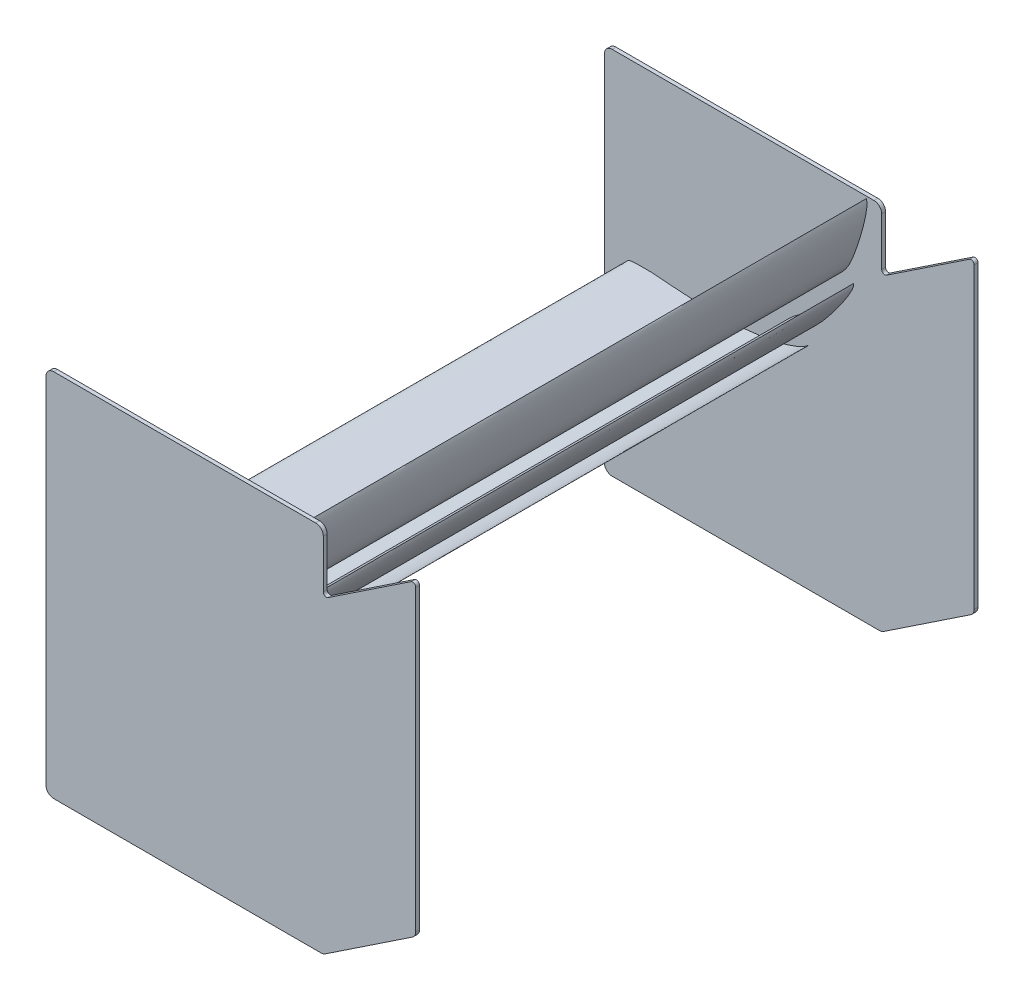
from build123d import *

# Parameters (mm, degrees)
BOSS_EXTRUDE1_DEPTH   = 457.2
BOSS_EXTRUDE1_2_DEPTH = 457.2
BOSS_EXTRUDE1_3_DEPTH = 457.2
SKETCH2_W             = 609.6
SKETCH2_H             = 609.6
BOSS_EXTRUDE2_DEPTH   = 6.35
CUT_EXTRUDE1_DEPTH    = 802.434403286
FILLET1_R             = 12.7
FILLET2_R             = 5.08


with BuildPart() as part:
    # Sketch1 → Boss-Extrude1 (new body)
    with BuildSketch(Plane.XY):
        with BuildLine():
            add(Edge.make_bspline(
                [(393.592739261, 288.346168055), (393.588820666, 288.346982898), (393.700690812, 287.655508378), (393.781579471, 286.908739604), (393.985442181, 284.967944897), (394.011725329, 282.452127067), (393.744454543, 279.067657192), (393.111282616, 275.075008274), (392.133345077, 270.514735181), (390.799217386, 265.484600894), (389.106489542, 260.051991759), (387.066182458, 254.292771701), (384.688600834, 248.282023779), (382.002029827, 242.092168445), (379.035294325, 235.794986076), (375.823030394, 229.460015305), (372.409485458, 223.151600098), (368.84167403, 216.93035856), (365.164200349, 210.854622388), (361.436467907, 204.970293648), (357.708308215, 199.322690258), (354.037147712, 193.948697266), (350.476057907, 188.878550101), (347.080927799, 184.135630335), (343.907393687, 179.733743247), (340.989793523, 175.685634093), (338.414599394, 171.923983227), (336.193200554, 168.419327874), (334.240625142, 165.213473878), (332.556462529, 162.326680984), (331.161408294, 159.786876212), (330.043654683, 157.635059186), (329.291548265, 155.86027552), (328.760233621, 154.554309494), (328.769589848, 153.394514108), (329.560454732, 152.715220708), (330.532294659, 152.20970073), (331.809851775, 151.88778366), (333.300191769, 151.766971046), (334.981201777, 151.878682049), (336.820730001, 152.233126013), (338.795136608, 152.890431356), (340.889679059, 153.849962511), (343.108390161, 155.081774595), (345.422265804, 156.598445557), (347.807181557, 158.394943192), (350.242618389, 160.465008768), (352.700102604, 162.811630509), (355.165323159, 165.419778956), (357.608143837, 168.287517472), (360.005969824, 171.408423599), (362.314130663, 174.79895484), (364.534653627, 178.459244555), (366.635689667, 182.423242356), (368.634788241, 186.684686876), (370.608508371, 191.198223557), (372.524007771, 195.951320397), (374.397359211, 200.905081481), (376.234904614, 206.023268877), (378.045854825, 211.259573163), (379.820915145, 216.568791762), (381.55512035, 221.902439326), (383.225308628, 227.222209295), (384.816697843, 232.490821437), (386.320164101, 237.674009405), (387.719679805, 242.741190647), (389.012797939, 247.660544998), (390.187380265, 252.402955689), (391.242055663, 256.938145967), (392.169544126, 261.238813051), (392.964570259, 265.279206189), (393.623921192, 269.03553403), (394.147236545, 272.485527514), (394.530778768, 275.610243672), (394.775632372, 278.392028119), (394.882726985, 280.816937707), (394.86231843, 282.876422035), (394.662580109, 284.618021211), (394.299795545, 285.992189628), (393.916147399, 287.192443924), (393.721364137, 287.743250305), (393.596579778, 288.345369449), (393.592739261, 288.346168055)],
                knots=[0, 0, 0, 0, 0.000999594, 0.004147435, 0.009748209, 0.018044377, 0.028864178, 0.04183079, 0.056713807, 0.073341232, 0.091507989, 0.111021837, 0.131661709, 0.153207715, 0.175433402, 0.198110317, 0.221011446, 0.243905882, 0.266573311, 0.288810349, 0.310405036, 0.331177743, 0.350943876, 0.3695564, 0.386864963, 0.402753039, 0.417195876, 0.430379519, 0.442362633, 0.453032156, 0.462284346, 0.470026206, 0.476176645, 0.480649947, 0.483553073, 0.486420689, 0.489953231, 0.494096927, 0.498850588, 0.50419675, 0.510125492, 0.516691031, 0.524011699, 0.532092122, 0.540897921, 0.550403414, 0.560581041, 0.571396483, 0.582828081, 0.594829641, 0.607347037, 0.620384325, 0.633968937, 0.648199967, 0.663193937, 0.678898581, 0.695226562, 0.712113221, 0.729459406, 0.747143117, 0.765009772, 0.782904928, 0.800688045, 0.818242105, 0.835449083, 0.852211621, 0.868429578, 0.884009363, 0.898854951, 0.912881827, 0.92601075, 0.938166771, 0.949289699, 0.959322172, 0.968216949, 0.97594822, 0.982474409, 0.987904723, 0.992516501, 0.996351138, 0.999020322, 1, 1, 1, 1], degree=3))
        make_face()
    extrude(amount=BOSS_EXTRUDE1_DEPTH)



with BuildPart() as body_2:
    # Sketch1 → Boss-Extrude1 2 (new body)
    with BuildSketch(Plane.XY):
        with BuildLine():
            add(Edge.make_bspline(
                [(298.35656861, 31.35853898), (298.353929072, 31.366096112), (297.283745146, 30.462041839), (296.086855075, 29.554142909), (292.96967767, 27.205487673), (288.683797757, 24.568945618), (282.60637468, 21.540875476), (275.109423189, 18.513611595), (266.284239098, 15.492695206), (256.286652726, 12.59841511), (245.229704329, 9.904315923), (233.254802442, 7.469649731), (220.501279173, 5.354092099), (207.122423277, 3.583751386), (193.270982166, 2.183151341), (179.101846113, 1.164544246), (164.77090042, 0.518354394), (150.430493327, 0.226424446), (136.226570648, 0.272373899), (122.299014003, 0.601647917), (108.776843715, 1.175499522), (95.782446704, 1.933474987), (83.422324309, 2.815736789), (71.794130294, 3.750557278), (60.978841147, 4.656777712), (51.03367721, 5.488659935), (41.932302919, 6.028617493), (33.635941017, 6.226776496), (26.128733222, 6.271870346), (19.444988538, 6.185472078), (13.65390124, 5.960869503), (8.81359552, 5.660537796), (4.996295589, 5.121737528), (2.2101383, 4.68734415), (0.231498565, 3.47662688), (-0.118386561, 1.421095916), (0.016052179, -0.765686971), (0.780159723, -3.287446437), (2.108210162, -5.966834049), (4.031288516, -8.73357683), (6.533778218, -11.522039441), (9.694408668, -14.229758447), (13.496904351, -16.832114888), (17.89408382, -19.366867852), (22.877633442, -21.771338344), (28.414076335, -24.009352574), (34.471546774, -26.052181026), (41.0258375, -27.84793216), (48.036441526, -29.387553548), (55.46899621, -30.621376512), (63.289216932, -31.517281604), (71.479303386, -31.981736227), (80.04157244, -32.018078442), (89.001418146, -31.536737631), (98.3661837, -30.574249123), (108.136977838, -29.30857935), (118.258486462, -27.696334558), (128.680585135, -25.805134609), (139.347682578, -23.683179508), (150.189876821, -21.393961956), (161.120101271, -18.968109829), (172.050121263, -16.44705467), (182.890408101, -13.830548059), (193.561824275, -11.131649945), (203.996227488, -8.370015866), (214.124679371, -5.549671519), (223.890108899, -2.699199091), (233.230096881, 0.17221793), (242.091326473, 3.035742743), (250.419492608, 5.875731769), (258.165015826, 8.67470357), (265.283800289, 11.41365917), (271.737298157, 14.070277557), (277.489184883, 16.631453444), (282.510312072, 19.07714225), (286.777734089, 21.391387781), (290.287356969, 23.54780056), (293.067295017, 25.684198648), (295.049383756, 27.721630892), (296.711834421, 29.615685508), (297.455459266, 30.51698171), (298.359155556, 31.351132423), (298.35656861, 31.35853898)],
                knots=[0, 0, 0, 0, 0.000999594, 0.004147435, 0.009748209, 0.018044377, 0.028864178, 0.04183079, 0.056713807, 0.073341232, 0.091507989, 0.111021837, 0.131661709, 0.153207715, 0.175433402, 0.198110317, 0.221011446, 0.243905882, 0.266573311, 0.288810349, 0.310405036, 0.331177743, 0.350943876, 0.3695564, 0.386864963, 0.402753039, 0.417195876, 0.430379519, 0.442362633, 0.453032156, 0.462284346, 0.470026206, 0.476176645, 0.480649947, 0.483553073, 0.486420689, 0.489953231, 0.494096927, 0.498850588, 0.50419675, 0.510125492, 0.516691031, 0.524011699, 0.532092122, 0.540897921, 0.550403414, 0.560581041, 0.571396483, 0.582828081, 0.594829641, 0.607347037, 0.620384325, 0.633968937, 0.648199967, 0.663193937, 0.678898581, 0.695226562, 0.712113221, 0.729459406, 0.747143117, 0.765009772, 0.782904928, 0.800688045, 0.818242105, 0.835449083, 0.852211621, 0.868429578, 0.884009363, 0.898854951, 0.912881827, 0.92601075, 0.938166771, 0.949289699, 0.959322172, 0.968216949, 0.97594822, 0.982474409, 0.987904723, 0.992516501, 0.996351138, 0.999020322, 1, 1, 1, 1], degree=3))
        make_face()
    extrude(amount=BOSS_EXTRUDE1_2_DEPTH)


with BuildPart() as body_3:
    # Sketch1 → Boss-Extrude1 3 (new body)
    with BuildSketch(Plane.XY):
        with BuildLine():
            add(Edge.make_bspline(
                [(372.766017178, 156.866017178), (372.762613596, 156.868123118), (372.631238932, 156.18008777), (372.451839445, 155.450689113), (371.979616845, 153.557213496), (371.14385455, 151.184128679), (369.735145293, 148.095179305), (367.774591951, 144.559874133), (365.295926005, 140.609093496), (362.321848809, 136.338611969), (358.873143189, 131.812576273), (354.986112409, 127.098505805), (350.696119636, 122.263431144), (346.054513477, 117.365731164), (341.112930801, 112.462998662), (335.927702478, 107.608732346), (330.562414418, 102.848262255), (325.081978424, 98.222470865), (319.548259387, 93.770916494), (314.03277776, 89.516415783), (308.597859487, 85.484510265), (303.3100832, 81.690219547), (298.229660927, 78.143804115), (293.417108121, 74.848120297), (288.929427481, 71.797112074), (284.803245263, 68.991011801), (281.096793975, 66.336984505), (277.810699151, 63.80344888), (274.879411801, 61.45875166), (272.309475303, 59.322071218), (270.12988874, 57.412572064), (268.343579153, 55.772819734), (267.029818537, 54.362304165), (266.0838794, 53.316817838), (265.695997993, 52.223766653), (266.206835862, 51.314947937), (266.947168655, 50.507525713), (268.037577528, 49.76807235), (269.396718675, 49.14481933), (271.014558788, 48.674854051), (272.864376861, 48.378766722), (274.944523848, 48.321144872), (277.240928916, 48.506433508), (279.747139912, 48.905114345), (282.440203799, 49.538926777), (285.295729912, 50.41139312), (288.292296056, 51.523650012), (291.404167743, 52.888244043), (294.612756613, 54.495946804), (297.889081516, 56.355245648), (301.209713663, 58.467833317), (304.538305351, 60.864453005), (307.876807208, 63.544536657), (311.206902367, 66.550879492), (314.54294041, 69.871595481), (317.941351115, 73.437880551), (321.366986629, 77.249191198), (324.821647229, 81.263480006), (328.298898272, 85.444525392), (331.791556364, 89.745660439), (335.275427154, 94.127587594), (338.729261892, 98.546443739), (342.118193979, 102.974154288), (345.415582162, 107.380743073), (348.601133001, 111.737130814), (351.649325636, 116.020061073), (354.546977485, 120.200469606), (357.272723813, 124.255147121), (359.814920931, 128.156111729), (362.157389768, 131.880197115), (364.286365798, 135.405009781), (366.190692791, 138.709292033), (367.862415633, 141.77224106), (369.291543297, 144.57733461), (370.473056738, 147.107612062), (371.40306068, 149.349653193), (372.088268037, 151.291915555), (372.49623741, 152.996797978), (372.625324711, 154.412173529), (372.675324526, 155.671259028), (372.680675009, 156.255467518), (372.769352944, 156.863953199), (372.766017178, 156.866017178)],
                knots=[0, 0, 0, 0, 0.000999594, 0.004147435, 0.009748209, 0.018044377, 0.028864178, 0.04183079, 0.056713807, 0.073341232, 0.091507989, 0.111021837, 0.131661709, 0.153207715, 0.175433402, 0.198110317, 0.221011446, 0.243905882, 0.266573311, 0.288810349, 0.310405036, 0.331177743, 0.350943876, 0.3695564, 0.386864963, 0.402753039, 0.417195876, 0.430379519, 0.442362633, 0.453032156, 0.462284346, 0.470026206, 0.476176645, 0.480649947, 0.483553073, 0.486420689, 0.489953231, 0.494096927, 0.498850588, 0.50419675, 0.510125492, 0.516691031, 0.524011699, 0.532092122, 0.540897921, 0.550403414, 0.560581041, 0.571396483, 0.582828081, 0.594829641, 0.607347037, 0.620384325, 0.633968937, 0.648199967, 0.663193937, 0.678898581, 0.695226562, 0.712113221, 0.729459406, 0.747143117, 0.765009772, 0.782904928, 0.800688045, 0.818242105, 0.835449083, 0.852211621, 0.868429578, 0.884009363, 0.898854951, 0.912881827, 0.92601075, 0.938166771, 0.949289699, 0.959322172, 0.968216949, 0.97594822, 0.982474409, 0.987904723, 0.992516501, 0.996351138, 0.999020322, 1, 1, 1, 1], degree=3))
        make_face()
    extrude(amount=BOSS_EXTRUDE1_3_DEPTH)


with BuildPart() as part_1:
    add(part.part)

    add(body_2.part)  # Boss-Extrude2 merges body 2

    add(body_3.part)  # Boss-Extrude2 merges body 3
    # Sketch2 → Boss-Extrude2 (add)
    with BuildSketch(Plane.XY.offset(457.2)):
        with Locations((266.7, -12.7)):
            Rectangle(SKETCH2_W, SKETCH2_H)
    extrude(amount=BOSS_EXTRUDE2_DEPTH)

    # Sketch3 → Cut-Extrude1 (cut, through all)
    with BuildSketch(Plane.XY.offset(463.55)):
        Polygon((419.1, 292.1), (419.1, 190.5), (571.5, 292.1), align=None)
        Polygon((571.5, -215.9), (419.1, -317.5), (571.5, -317.5), align=None)
    extrude(amount=-CUT_EXTRUDE1_DEPTH, mode=Mode.SUBTRACT)

    # Fillet1
    fillet1_edges = [part_1.edges().sort_by_distance(p)[0] for p in [
        (-38.1, 292.1, 460.375),
        (-38.1, -317.5, 460.375),
        (419.1, 292.1, 460.375),
        (571.5, -215.9, 460.375),
        (419.1, -317.5, 460.375),
    ]]
    fillet(fillet1_edges, radius=FILLET1_R)

    # Fillet2
    fillet2_edges = [part_1.edges().sort_by_distance(p)[0] for p in [
        (571.5, 292.1, 460.375),
        (419.1, 190.5, 460.375),
    ]]
    fillet(fillet2_edges, radius=FILLET2_R)

    # Mirror1: part across plane


with BuildPart() as part_2:
    add(part_1.part)
    add(part_1.part.mirror(Plane(origin=(2.487951644, -6.438142872, 0), x_dir=(1, 0, 0), z_dir=(0, 0, -1))))


solid = part_2.part
